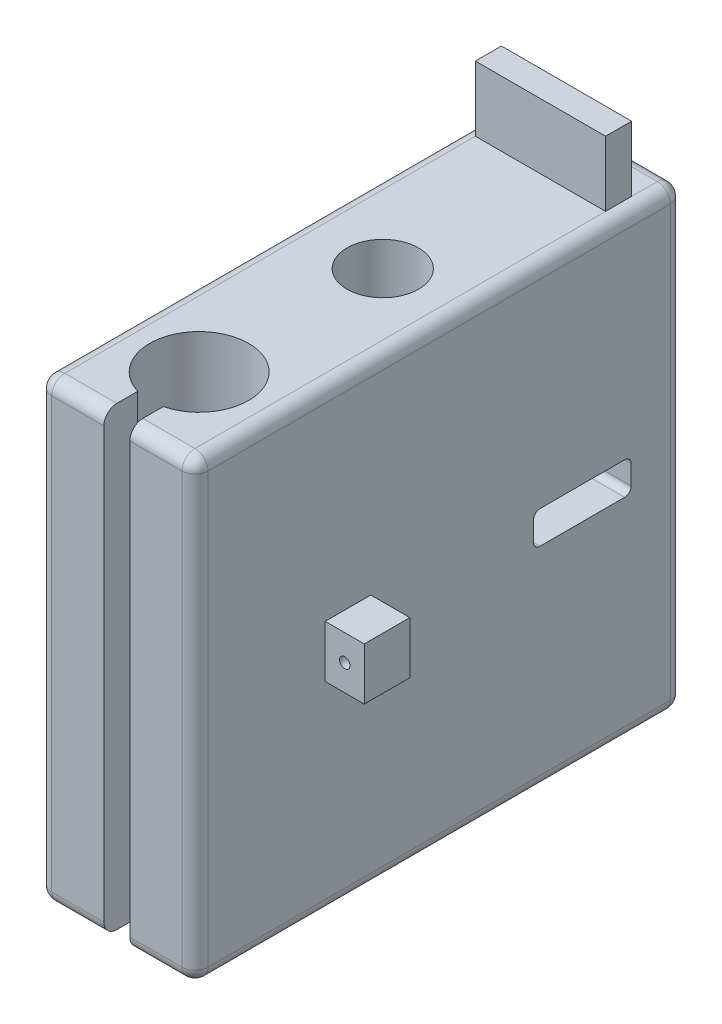
from build123d import *

# Parameters (mm, degrees)
RESSALTO_EXTRUS_O1_DEPTH                   = 12
RESSALTO_EXTRUS_O1_DEPTH_BACK              = 12
ESBO_O1_W                                  = 75
ESBO_O1_H                                  = 70
ESBO_O3_R                                  = 5.5
CORTE_EXTRUS_O1_DEPTH                      = 525.799189678
ESBO_O4_R                                  = 4.1
CORTE_EXTRUS_O2_DEPTH                      = 20
FILETE1_R                                  = 2
CORTE_EXTRUS_O3_DEPTH                      = 29
CORTE_EXTRUS_O4_DEPTH                      = 28
RESSALTO_EXTRUS_O2_DEPTH                   = 6
RESSALTO_EXTRUS_O2_DEPTH_BACK              = 30
ESBO_O7_W                                  = 7
ESBO_O7_H                                  = 8
BROCA_DE_ROSQUEAR_PARA_TARRAXA_DE_M2X0_4_D = 1.6
BROCA_DE_ROSQUEAR_PARA_TARRAXA_DE_M2_2_D   = 1.6
ESBO_O18_W                                 = 20
ESBO_O18_H                                 = 4
RESSALTO_EXTRUS_O3_DEPTH                   = 10


with BuildPart() as part:
    # Esboço1 → Ressalto-extrusão1 (new, two sides: drawn at the far end of the back side and taken through both)
    with BuildSketch(Plane(origin=(-220, 0, 0), x_dir=(0, 0, -1), z_dir=(1, 0, 0)).offset(-RESSALTO_EXTRUS_O1_DEPTH_BACK)):
        with Locations((-427.999935002, 213.253952806)):
            Rectangle(ESBO_O1_W, ESBO_O1_H)
    extrude(amount=RESSALTO_EXTRUS_O1_DEPTH + RESSALTO_EXTRUS_O1_DEPTH_BACK)

    # Esboço3 → Corte-extrusão1 (cut, through all)
    with BuildSketch(Plane(origin=(0, 248.253952806, 0), x_dir=(1, 0, 0), z_dir=(0, 1, 0))):
        with Locations((-219.508549322, -425.149935105)):
            Circle(ESBO_O3_R)
        with BuildLine():
            Line((-220, -465.499935002), (-218, -465.499935002))
            Line((-218, -465.499935002), (-218, -460.369179456))
            ThreePointArc((-218, -460.369179456), (-219.711945476, -445.401349285), (-222, -460.292000844))
            Line((-222, -460.292000844), (-222, -465.499935002))
            Line((-222, -465.499935002), (-220, -465.499935002))
        make_face()
    extrude(amount=-CORTE_EXTRUS_O1_DEPTH, mode=Mode.SUBTRACT)

    # Esboço4 → Corte-extrusão2 (cut)
    with BuildSketch(Plane(origin=(0, 0, 390.499935002), x_dir=(-1, 0, 0), z_dir=(0, 0, -1))):
        with Locations((219.858557552, 238.253952806)):
            Circle(ESBO_O4_R)
        with Locations((219.858557552, 188.253952806)):
            Circle(ESBO_O4_R)
    extrude(amount=-CORTE_EXTRUS_O2_DEPTH, mode=Mode.SUBTRACT)

    # Filete1
    filete1_edges = [part.edges().sort_by_distance(p)[0] for p in [
        (-227, 178.253952806, 465.499935002),
        (-213, 178.253952806, 465.499935002),
        (-213, 248.253952806, 465.499935002),
        (-227, 248.253952806, 465.499935002),
        (-208, 178.253952806, 427.999935002),
        (-208, 248.253952806, 427.999935002),
        (-208, 213.253952806, 465.499935002),
        (-232, 178.253952806, 427.999935002),
        (-232, 213.253952806, 465.499935002),
        (-232, 248.253952806, 427.999935002),
        (-220, 248.253952806, 390.499935002),
        (-220, 178.253952806, 390.499935002),
        (-208, 213.253952806, 390.499935002),
        (-232, 213.253952806, 390.499935002),
    ]]
    fillet(filete1_edges, radius=FILETE1_R)

    # Esboço5 → Corte-extrusão3 (cut)
    with BuildSketch(Plane(origin=(0, 0, 390.499935002), x_dir=(-1, 0, 0), z_dir=(0, 0, -1))):
        Polygon((214.029355297, 195.258459884), (226.029351267, 195.248625677), (226.058853888, 231.248613588), (214.058857917, 231.258447795), align=None)
    extrude(amount=-CORTE_EXTRUS_O3_DEPTH, mode=Mode.SUBTRACT)

    # Esboço6 → Corte-extrusão4 (cut)
    with BuildSketch(Plane.ZY.offset(232)):
        with BuildLine():
            Line((399.499935002, 215.753952806), (412.499935002, 215.753952806))
            ThreePointArc((412.499935002, 215.753952806), (413.207041783, 215.461059587), (413.499935002, 214.753952806))
            Line((413.499935002, 214.753952806), (413.499935002, 211.753952806))
            ThreePointArc((413.499935002, 211.753952806), (413.207041783, 211.046846025), (412.499935002, 210.753952806))
            Line((412.499935002, 210.753952806), (399.499935002, 210.753952806))
            ThreePointArc((399.499935002, 210.753952806), (398.792828221, 211.046846025), (398.499935002, 211.753952806))
            Line((398.499935002, 211.753952806), (398.499935002, 214.753952806))
            ThreePointArc((398.499935002, 214.753952806), (398.792828221, 215.461059587), (399.499935002, 215.753952806))
        make_face()
    extrude(amount=-CORTE_EXTRUS_O4_DEPTH, mode=Mode.SUBTRACT)

    # Esboço7 → Ressalto-extrusão2 (add, two sides: drawn at the far end of the back side and taken through both)
    with BuildSketch(Plane(origin=(-208, 0, 0), x_dir=(0, 0, -1), z_dir=(1, 0, 0)).offset(-RESSALTO_EXTRUS_O2_DEPTH_BACK)):
        with Locations((-441.999935002, 213.253952806)):
            Rectangle(ESBO_O7_W, ESBO_O7_H)
    extrude(amount=RESSALTO_EXTRUS_O2_DEPTH + RESSALTO_EXTRUS_O2_DEPTH_BACK)

    # Broca de rosquear para tarraxa de M2x0.4 (through all)
    with Locations(Plane.XY.offset(445.499935002)):
        with Locations((-205, 213.253952806)):
            Hole(BROCA_DE_ROSQUEAR_PARA_TARRAXA_DE_M2X0_4_D / 2)

    # Broca de rosquear para tarraxa de M2 2 (through all)
    with Locations(Plane.XY.offset(445.499935002)):
        with Locations((-235, 213.253952806)):
            Hole(BROCA_DE_ROSQUEAR_PARA_TARRAXA_DE_M2_2_D / 2)

    # Esboço18 → Ressalto-extrusão3 (add)
    with BuildSketch(Plane(origin=(0, 248.253952806, 0), x_dir=(1, 0, 0), z_dir=(0, 1, 0))):
        with Locations((-220, -398.434558943)):
            Rectangle(ESBO_O18_W, ESBO_O18_H)
    extrude(amount=RESSALTO_EXTRUS_O3_DEPTH)


solid = part.part
